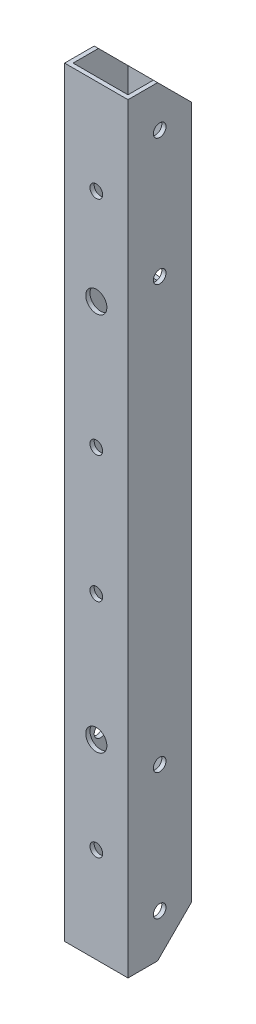
from build123d import *

# Parameters (mm, degrees)
SKETCH_1_W          = 15
SKETCH_1_H          = 15
SKETCH_1_W_2        = 13
SKETCH_1_H_2        = 13
EXTRUDE_1_DEPTH     = 180
SKETCH_2_R          = 2.5
SKETCH_2_R_2        = 1.5
CUT_EXTRUDE_1_DEPTH = 181.779561898
SKETCH_3_R          = 1.5
CUT_EXTRUDE_2_DEPTH = 181.779561898


with BuildPart() as part:
    # 草图1 → 凸台-拉伸1 (new body)
    with BuildSketch(Plane(origin=(0, 0, 0), x_dir=(1, 0, 0), z_dir=(0, 1, 0))):
        Rectangle(SKETCH_1_W, SKETCH_1_H)
        Rectangle(SKETCH_1_W_2, SKETCH_1_H_2, mode=Mode.SUBTRACT)
    extrude(amount=EXTRUDE_1_DEPTH)

    # 草图2 → 切除-拉伸1 (cut, through all)
    with BuildSketch(Plane.XY.offset(7.5)):
        with Locations((0, 134.901280605)):
            Circle(SKETCH_2_R)
        with Locations((0, 45.098719395)):
            Circle(SKETCH_2_R)
        with Locations((0, 187.5)):
            Circle(SKETCH_2_R_2)
        with Locations((0, 157.5)):
            Circle(SKETCH_2_R_2)
        with Locations((0, -7.5)):
            Circle(SKETCH_2_R_2)
        with Locations((0, 22.5)):
            Circle(SKETCH_2_R_2)
        with Locations((0, 105)):
            Circle(SKETCH_2_R_2)
        with Locations((0, 75)):
            Circle(SKETCH_2_R_2)
    extrude(amount=-CUT_EXTRUDE_1_DEPTH, mode=Mode.SUBTRACT)

    # 草图3 → 切除-拉伸2 (cut, through all)
    with BuildSketch(Plane(origin=(7.5, 0, 0), x_dir=(0, 0, -1), z_dir=(1, 0, 0))):
        with Locations((0, 170)):
            Circle(SKETCH_3_R)
        with Locations((0, 140)):
            Circle(SKETCH_3_R)
        with Locations(Location((0, 10, 0), (0, 0, 180))):
            Circle(SKETCH_3_R)
        with Locations(Location((0, 40, 0), (0, 0, 180))):
            Circle(SKETCH_3_R)
        Polygon((7.5, 172), (7.5, 180), (-0.5, 180), align=None)
        Polygon((-0.5, 0), (7.5, 8), (7.5, 0), align=None)
    extrude(amount=-CUT_EXTRUDE_2_DEPTH, mode=Mode.SUBTRACT)


solid = part.part
